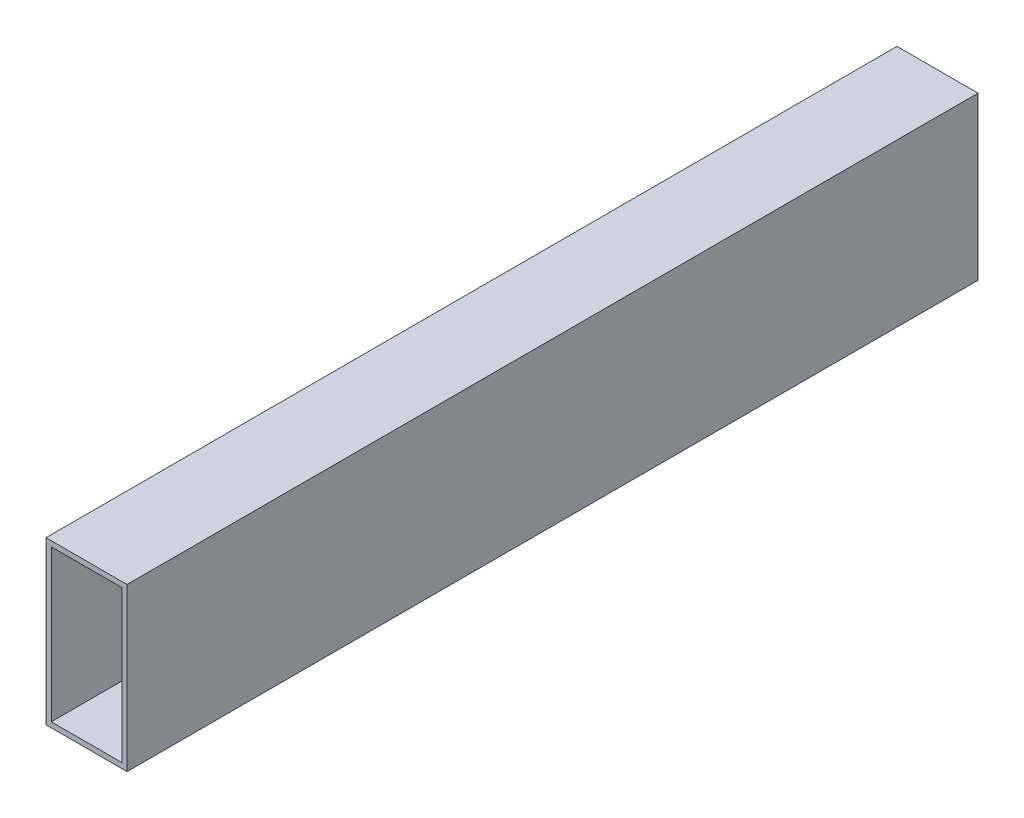
from build123d import *

# Parameters (mm, degrees)
SKETCH1_W           = 25.4
SKETCH1_H           = 50.8
BOSS_EXTRUDE1_DEPTH = 266.7
SKETCH2_W           = 22.098
SKETCH2_H           = 47.498
CUT_EXTRUDE1_DEPTH  = 273.739909307


with BuildPart() as part:
    # Sketch1 → Boss-Extrude1 (new body)
    with BuildSketch(Plane.XY):
        with Locations((-35.737209302, -4.799418605)):
            Rectangle(SKETCH1_W, SKETCH1_H)
    extrude(amount=BOSS_EXTRUDE1_DEPTH)

    # Sketch2 → Cut-Extrude1 (cut, through all)
    with BuildSketch(Plane.XY.offset(266.7)):
        with Locations((-35.737209302, -4.799418605)):
            Rectangle(SKETCH2_W, SKETCH2_H)
    extrude(amount=-CUT_EXTRUDE1_DEPTH, mode=Mode.SUBTRACT)


solid = part.part
